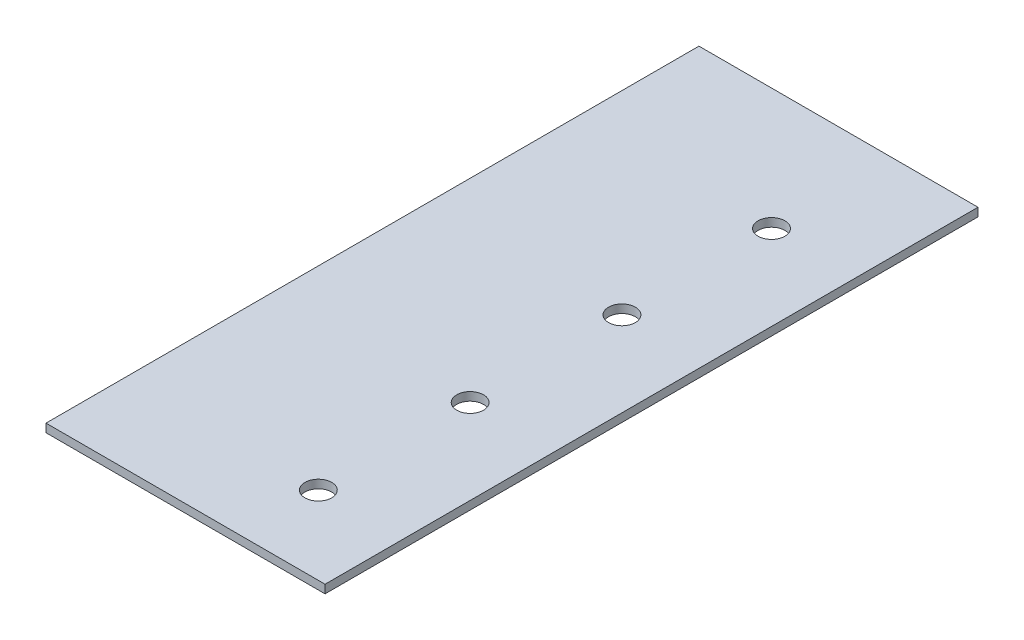
from build123d import *

# Parameters (mm, degrees)
SKETCH1_W           = 63.5
SKETCH1_H           = 148.59
BOSS_EXTRUDE1_DEPTH = 1.905
SKETCH3_R           = 3.048
CUT_EXTRUDE2_DEPTH  = 2.54


with BuildPart() as part:
    # Sketch1 → Boss-Extrude1 (new body)
    with BuildSketch(Plane(origin=(0, 0, 0), x_dir=(1, 0, 0), z_dir=(0, 1, 0))):
        with Locations((31.75, 74.295)):
            Rectangle(SKETCH1_W, SKETCH1_H)
    extrude(amount=BOSS_EXTRUDE1_DEPTH)

    # Sketch3 → Cut-Extrude2 (cut)
    with BuildSketch(Plane.XZ):
        with Locations((44.196, -86.868)):
            Circle(SKETCH3_R)
        with Locations((44.196, -52.324)):
            Circle(SKETCH3_R)
        with Locations((44.196, -17.78)):
            Circle(SKETCH3_R)
        with Locations((44.196, -120.904)):
            Circle(SKETCH3_R)
    extrude(amount=-CUT_EXTRUDE2_DEPTH, mode=Mode.SUBTRACT)


solid = part.part
